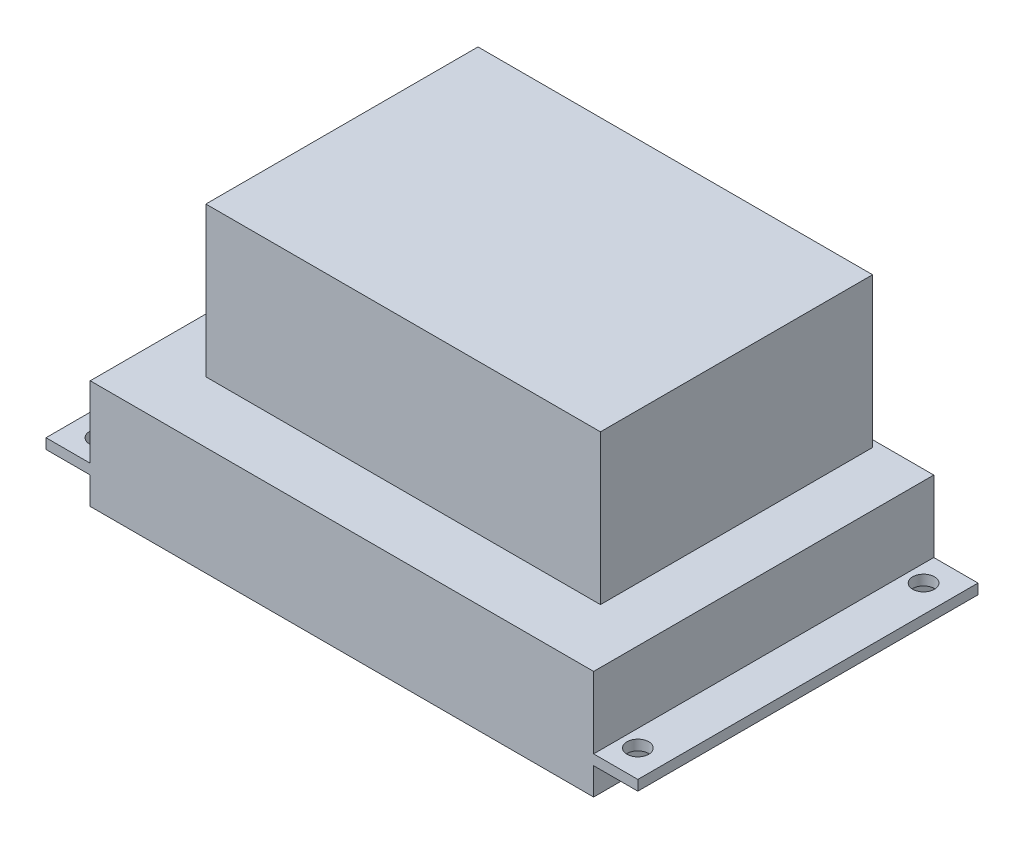
from build123d import *

# Parameters (mm, degrees)
SKETCH_1_W           = 87
SKETCH_1_H           = 50
SKETCH_1_R           = 1.6
EXTRUDE_1_DEPTH      = 1.5
EXTRUDE_2_DEPTH      = 4
EXTRUDE_2_DEPTH_BACK = 12
SKETCH_2_W           = 74
SKETCH_2_H           = 50
SKETCH_3_W           = 58
SKETCH_3_H           = 40
EXTRUDE_3_DEPTH      = 22


with BuildPart() as part:
    # 草图1 → 凸台-拉伸1 (new body)
    with BuildSketch(Plane(origin=(0, 0, 0), x_dir=(1, 0, 0), z_dir=(0, 1, 0))):
        Rectangle(SKETCH_1_W, SKETCH_1_H)
        with Locations(Location((-39.5, 21, 0), (0, 0, 270))):
            Circle(SKETCH_1_R, mode=Mode.SUBTRACT)
        with Locations(Location((-39.5, -21, 0), (0, 0, 90))):
            Circle(SKETCH_1_R, mode=Mode.SUBTRACT)
        with Locations(Location((39.5, -21, 0), (0, 0, 270))):
            Circle(SKETCH_1_R, mode=Mode.SUBTRACT)
        with Locations(Location((39.5, 21, 0), (0, 0, 90))):
            Circle(SKETCH_1_R, mode=Mode.SUBTRACT)
    extrude(amount=EXTRUDE_1_DEPTH)

    # 草图2 → 凸台-拉伸2 (add, two sides: drawn at the far end of the back side and taken through both)
    with BuildSketch(Plane.XZ.offset(-EXTRUDE_2_DEPTH_BACK)):
        Rectangle(SKETCH_2_W, SKETCH_2_H)
    extrude(amount=EXTRUDE_2_DEPTH + EXTRUDE_2_DEPTH_BACK)

    # 草图3 → 凸台-拉伸3 (add)
    with BuildSketch(Plane(origin=(0, 12, 0), x_dir=(1, 0, 0), z_dir=(0, 1, 0))):
        with Locations((0, 4)):
            Rectangle(SKETCH_3_W, SKETCH_3_H)
    extrude(amount=EXTRUDE_3_DEPTH)


solid = part.part
